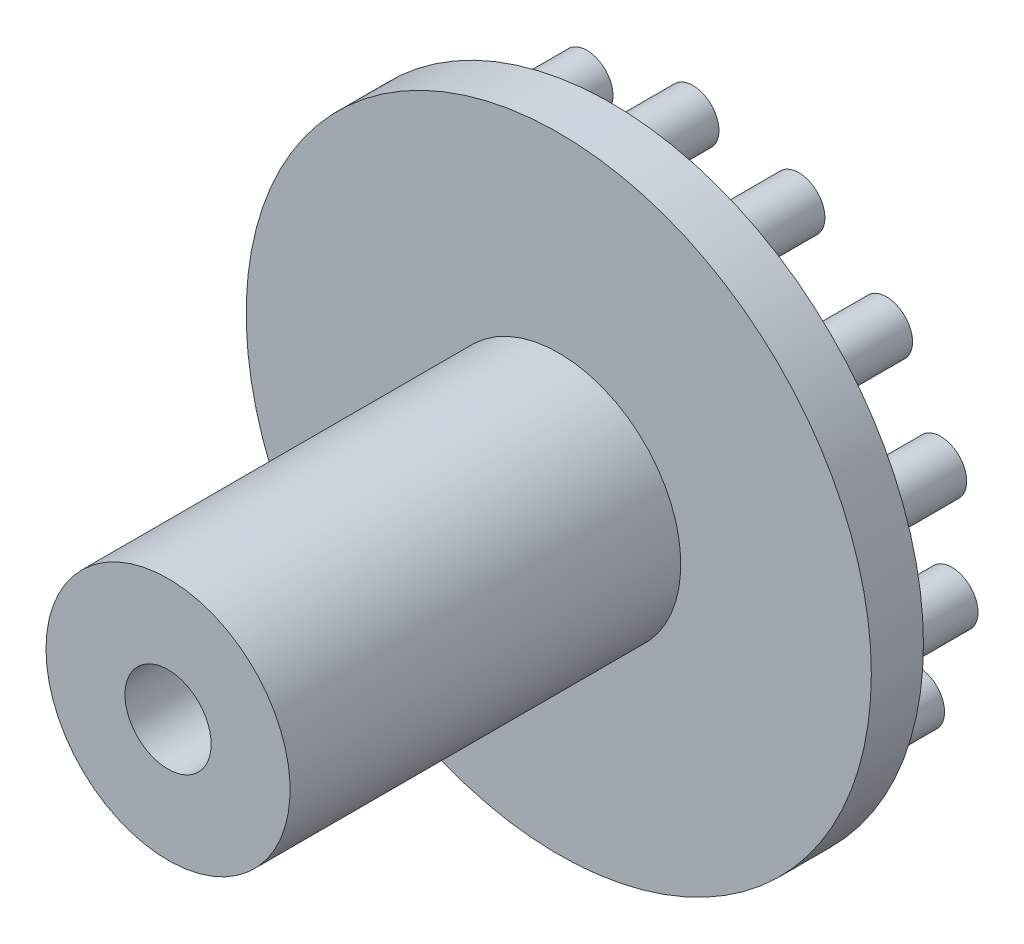
from build123d import *

# Parameters (mm, degrees)
SKETCH1_R             = 15.24
SKETCH1_R_2           = 4.55
BOSS_EXTRUDE1_DEPTH   = 2.54
SKETCH2_R             = 5.95
BOSS_EXTRUDE2_DEPTH   = 19.05
SKETCH5_R             = 1.27
BOSS_EXTRUDE5_DEPTH   = 4.000000128
M5X0_8_TAPPED_HOLE2_D = 4.2


with BuildPart() as part:
    # Sketch1 → Boss-Extrude1 (new body)
    with BuildSketch(Plane.XY):
        Circle(SKETCH1_R)
        Circle(SKETCH1_R_2, mode=Mode.SUBTRACT)
    extrude(amount=BOSS_EXTRUDE1_DEPTH)

    # Sketch2 → Boss-Extrude2 (add)
    with BuildSketch(Plane.XY.offset(2.54)):
        with Locations(Location((0, 0, 0), (0, 0, 180))):
            Circle(SKETCH2_R)
    extrude(amount=BOSS_EXTRUDE2_DEPTH)

    # Sketch5 → Boss-Extrude5 (add)
    with BuildSketch(Plane(origin=(0, 0, 0), x_dir=(-1, 0, 0), z_dir=(0, 0, -1))):
        with Locations(Location((0, 12.7, 0), (0, 0, 180))):
            Circle(SKETCH5_R)
        with Locations(Location((5.165555367, 11.602027312, 0), (0, 0, 180))):
            Circle(SKETCH5_R)
        with Locations(Location((9.437939284, 8.497958701, 0), (0, 0, 180))):
            Circle(SKETCH5_R)
        with Locations(Location((12.078417757, 3.924515829, 0), (0, 0, 180))):
            Circle(SKETCH5_R)
        with Locations(Location((12.630428071, -1.327511483, 0), (0, 0, 180))):
            Circle(SKETCH5_R)
        with Locations(Location((10.998522628, -6.35, 0), (0, 0, 180))):
            Circle(SKETCH5_R)
        with Locations(Location((7.464872704, -10.274515829, 0), (0, 0, 180))):
            Circle(SKETCH5_R)
        with Locations(Location((2.640478473, -12.422474529, 0), (0, 0, 180))):
            Circle(SKETCH5_R)
        with Locations(Location((-2.640478473, -12.422474529, 0), (0, 0, 180))):
            Circle(SKETCH5_R)
        with Locations(Location((-7.464872704, -10.274515829, 0), (0, 0, 180))):
            Circle(SKETCH5_R)
        with Locations(Location((-10.998522628, -6.35, 0), (0, 0, 180))):
            Circle(SKETCH5_R)
        with Locations(Location((-12.630428071, -1.327511483, 0), (0, 0, 180))):
            Circle(SKETCH5_R)
        with Locations(Location((-12.078417757, 3.924515829, 0), (0, 0, 180))):
            Circle(SKETCH5_R)
        with Locations(Location((-9.437939284, 8.497958701, 0), (0, 0, 180))):
            Circle(SKETCH5_R)
        with Locations(Location((-5.165555367, 11.602027312, 0), (0, 0, 180))):
            Circle(SKETCH5_R)
    extrude(amount=BOSS_EXTRUDE5_DEPTH)

    # M5x0.8 Tapped Hole2 (through all)
    with Locations(Plane.XY.offset(21.59)):
        with Locations((0, 0)):
            Hole(M5X0_8_TAPPED_HOLE2_D / 2)


solid = part.part
